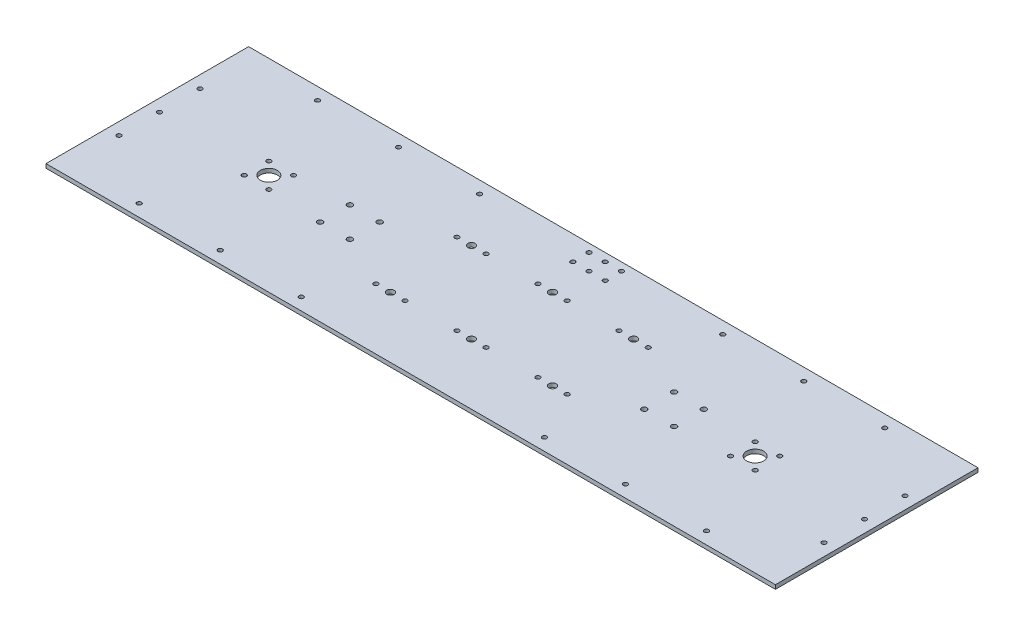
from build123d import *

# Parameters (mm, degrees)
SKETCH_1_W          = 900
SKETCH_1_H          = 250
SKETCH_1_R          = 4.5
SKETCH_1_R_2        = 10.5
SKETCH_1_R_3        = 2.75
SKETCH_1_R_4        = 3.3
EXTRUDE_1_DEPTH     = 5
SKETCH_2_R          = 2.75
CUT_EXTRUDE_1_DEPTH = 935.090466711
SKETCH_3_R          = 2.75
CUT_EXTRUDE_2_DEPTH = 935.090466711
SKETCH_5_R          = 2.75
CUT_EXTRUDE_4_DEPTH = 935.090466711


with BuildPart() as part:
    # 草图1 → 凸台-拉伸1 (new body)
    with BuildSketch(Plane(origin=(0, 0, 0), x_dir=(1, 0, 0), z_dir=(0, 1, 0))):
        with Locations((-450, 125)):
            Rectangle(SKETCH_1_W, SKETCH_1_H)
        with Locations(Location((-550, 175, 0), (0, 0, 270))):
            Circle(SKETCH_1_R, mode=Mode.SUBTRACT)
        with Locations(Location((-450, 175, 0), (0, 0, 270))):
            Circle(SKETCH_1_R, mode=Mode.SUBTRACT)
        with Locations(Location((-350, 175, 0), (0, 0, 270))):
            Circle(SKETCH_1_R, mode=Mode.SUBTRACT)
        with Locations(Location((-350, 75, 0), (0, 0, 270))):
            Circle(SKETCH_1_R, mode=Mode.SUBTRACT)
        with Locations(Location((-450, 75, 0), (0, 0, 270))):
            Circle(SKETCH_1_R, mode=Mode.SUBTRACT)
        with Locations(Location((-550, 75, 0), (0, 0, 270))):
            Circle(SKETCH_1_R, mode=Mode.SUBTRACT)
        with Locations(Location((-750, 125, 0), (0, 0, 270))):
            Circle(SKETCH_1_R_2, mode=Mode.SUBTRACT)
        with Locations(Location((-150, 125, 0), (0, 0, 270))):
            Circle(SKETCH_1_R_2, mode=Mode.SUBTRACT)
        with Locations(Location((-765.202795796, 140.202795796, 0), (0, 0, 270))):
            Circle(SKETCH_1_R_3, mode=Mode.SUBTRACT)
        with Locations(Location((-668.384776311, 143.384776311, 0), (0, 0, 270))):
            Circle(SKETCH_1_R_4, mode=Mode.SUBTRACT)
        with Locations(Location((-231.615223689, 143.384776311, 0), (0, 0, 90))):
            Circle(SKETCH_1_R_4, mode=Mode.SUBTRACT)
        with Locations(Location((-134.797204204, 140.202795796, 0), (0, 0, 90))):
            Circle(SKETCH_1_R_3, mode=Mode.SUBTRACT)
        with Locations(Location((-734.797204204, 140.202795796, 0), (0, 0, 90))):
            Circle(SKETCH_1_R_3, mode=Mode.SUBTRACT)
        with Locations(Location((-734.797204204, 109.797204204, 0), (0, 0, 270))):
            Circle(SKETCH_1_R_3, mode=Mode.SUBTRACT)
        with Locations(Location((-765.202795796, 109.797204204, 0), (0, 0, 90))):
            Circle(SKETCH_1_R_3, mode=Mode.SUBTRACT)
        with Locations(Location((-631.615223689, 143.384776311, 0), (0, 0, 90))):
            Circle(SKETCH_1_R_4, mode=Mode.SUBTRACT)
        with Locations(Location((-631.615223689, 106.615223689, 0), (0, 0, 270))):
            Circle(SKETCH_1_R_4, mode=Mode.SUBTRACT)
        with Locations(Location((-668.384776311, 106.615223689, 0), (0, 0, 90))):
            Circle(SKETCH_1_R_4, mode=Mode.SUBTRACT)
        with Locations(Location((-268.384776311, 143.384776311, 0), (0, 0, 270))):
            Circle(SKETCH_1_R_4, mode=Mode.SUBTRACT)
        with Locations(Location((-268.384776311, 106.615223689, 0), (0, 0, 90))):
            Circle(SKETCH_1_R_4, mode=Mode.SUBTRACT)
        with Locations(Location((-231.615223689, 106.615223689, 0), (0, 0, 270))):
            Circle(SKETCH_1_R_4, mode=Mode.SUBTRACT)
        with Locations(Location((-165.202795796, 109.797204204, 0), (0, 0, 90))):
            Circle(SKETCH_1_R_3, mode=Mode.SUBTRACT)
        with Locations(Location((-134.797204204, 109.797204204, 0), (0, 0, 270))):
            Circle(SKETCH_1_R_3, mode=Mode.SUBTRACT)
        with Locations(Location((-165.202795796, 140.202795796, 0), (0, 0, 270))):
            Circle(SKETCH_1_R_3, mode=Mode.SUBTRACT)
    extrude(amount=EXTRUDE_1_DEPTH)

    # 草图2 → 切除-拉伸1 (cut, through all)
    with BuildSketch(Plane(origin=(0, 5, 0), x_dir=(1, 0, 0), z_dir=(0, 1, 0))):
        with Locations(Location((-470, 240, 0), (0, 0, 270))):
            Circle(SKETCH_2_R)
        with Locations(Location((-430, 240, 0), (0, 0, 270))):
            Circle(SKETCH_2_R)
        with Locations(Location((-430, 220, 0), (0, 0, 270))):
            Circle(SKETCH_2_R)
        with Locations(Location((-470, 220, 0), (0, 0, 270))):
            Circle(SKETCH_2_R)
        with Locations(Location((-450, 220, 0), (0, 0, 270))):
            Circle(SKETCH_2_R)
        with Locations(Location((-450, 240, 0), (0, 0, 270))):
            Circle(SKETCH_2_R)
        with Locations(Location((-885, 175, 0), (0, 0, 270))):
            Circle(SKETCH_2_R)
        with Locations(Location((-885, 125, 0), (0, 0, 270))):
            Circle(SKETCH_2_R)
        with Locations(Location((-885, 75, 0), (0, 0, 90))):
            Circle(SKETCH_2_R)
        with Locations(Location((-15, 175, 0), (0, 0, 90))):
            Circle(SKETCH_2_R)
        with Locations(Location((-15, 125, 0), (0, 0, 90))):
            Circle(SKETCH_2_R)
        with Locations(Location((-15, 75, 0), (0, 0, 270))):
            Circle(SKETCH_2_R)
    extrude(amount=-CUT_EXTRUDE_1_DEPTH, mode=Mode.SUBTRACT)

    # 草图3 → 切除-拉伸2 (cut, through all)
    with BuildSketch(Plane(origin=(0, 5, 0), x_dir=(1, 0, 0), z_dir=(0, 1, 0))):
        with Locations(Location((-568, 175, 0), (0, 0, 270))):
            Circle(SKETCH_3_R)
        with Locations(Location((-532, 175, 0), (0, 0, 270))):
            Circle(SKETCH_3_R)
        with Locations(Location((-468, 175, 0), (0, 0, 270))):
            Circle(SKETCH_3_R)
        with Locations(Location((-432, 175, 0), (0, 0, 90))):
            Circle(SKETCH_3_R)
        with Locations(Location((-368, 175, 0), (0, 0, 90))):
            Circle(SKETCH_3_R)
        with Locations(Location((-332, 175, 0), (0, 0, 90))):
            Circle(SKETCH_3_R)
        with Locations(Location((-332, 75, 0), (0, 0, 270))):
            Circle(SKETCH_3_R)
        with Locations(Location((-368, 75, 0), (0, 0, 270))):
            Circle(SKETCH_3_R)
        with Locations(Location((-432, 75, 0), (0, 0, 270))):
            Circle(SKETCH_3_R)
        with Locations(Location((-468, 75, 0), (0, 0, 90))):
            Circle(SKETCH_3_R)
        with Locations(Location((-532, 75, 0), (0, 0, 90))):
            Circle(SKETCH_3_R)
        with Locations(Location((-568, 75, 0), (0, 0, 90))):
            Circle(SKETCH_3_R)
    extrude(amount=-CUT_EXTRUDE_2_DEPTH, mode=Mode.SUBTRACT)

    # 草图5 → 切除-拉伸4 (cut, through all)
    with BuildSketch(Plane(origin=(0, 5, 0), x_dir=(1, 0, 0), z_dir=(0, 1, 0))):
        with Locations(Location((-800, 235, 0), (0, 0, 270))):
            Circle(SKETCH_5_R)
        with Locations(Location((-700, 235, 0), (0, 0, 270))):
            Circle(SKETCH_5_R)
        with Locations(Location((-600, 235, 0), (0, 0, 270))):
            Circle(SKETCH_5_R)
        with Locations(Location((-600, 15, 0), (0, 0, 90))):
            Circle(SKETCH_5_R)
        with Locations(Location((-700, 15, 0), (0, 0, 90))):
            Circle(SKETCH_5_R)
        with Locations(Location((-800, 15, 0), (0, 0, 90))):
            Circle(SKETCH_5_R)
        with Locations(Location((-300, 15, 0), (0, 0, 270))):
            Circle(SKETCH_5_R)
        with Locations(Location((-200, 15, 0), (0, 0, 270))):
            Circle(SKETCH_5_R)
        with Locations(Location((-100, 15, 0), (0, 0, 270))):
            Circle(SKETCH_5_R)
        with Locations(Location((-300, 235, 0), (0, 0, 90))):
            Circle(SKETCH_5_R)
        with Locations(Location((-200, 235, 0), (0, 0, 90))):
            Circle(SKETCH_5_R)
        with Locations(Location((-100, 235, 0), (0, 0, 90))):
            Circle(SKETCH_5_R)
    extrude(amount=-CUT_EXTRUDE_4_DEPTH, mode=Mode.SUBTRACT)


solid = part.part
